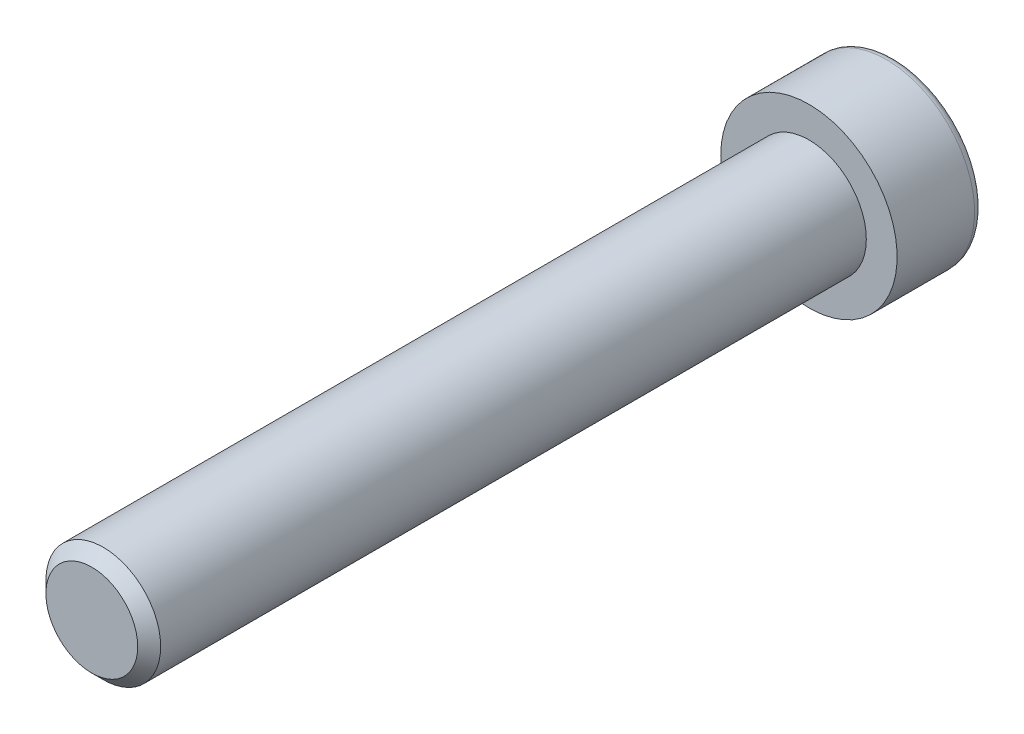
from build123d import *

# Parameters (mm, degrees)
ENLEV_MAT_EXTRU1_DEPTH = 3
ESQUISSE3_W            = 4
ESQUISSE3_H            = 50
CHANFREIN1_SIZE        = 0.8


with BuildPart() as part:
    # Esquisse1 → Base-Révolution (revolve)
    with BuildSketch(Plane(origin=(0, 0, 0), x_dir=(1, 0, 0), z_dir=(0, 1, 0))):
        with BuildLine():
            Line((0, 0), (6.15, 0))
            Line((6.15, 0), (6.15, 5.4))
            ThreePointArc((6.15, 5.4), (5.974264069, 5.824264069), (5.55, 6))
            Line((5.55, 6), (0, 6))
            Line((0, 6), (0, 0))
        make_face()
    revolve(axis=Axis((0, 0, 0), (0, 0, -1)))

    # Esquisse2 → enlev-mat-Extru1 (cut)
    with BuildSketch(Plane.XY.offset(-6)):
        Polygon((3, -1.732050808), (3, 1.732050808), (0, 3.464101615), (-3, 1.732050808), (-3, -1.732050808), (0, -3.464101615), align=None)
    extrude(amount=ENLEV_MAT_EXTRU1_DEPTH, mode=Mode.SUBTRACT)

    # Esquisse3 → Boss.-Révol.1 (revolve)
    with BuildSketch(Plane(origin=(0, 0, 0), x_dir=(1, 0, 0), z_dir=(0, 1, 0))):
        with Locations((2, -25)):
            Rectangle(ESQUISSE3_W, ESQUISSE3_H)
    revolve(axis=Axis((0, 0, 0), (0, 0, 1)))

    # Chanfrein1
    chanfrein1_edges = [part.edges().sort_by_distance(p)[0] for p in [
        (-4, 0, 50),
    ]]
    chamfer(chanfrein1_edges, length=CHANFREIN1_SIZE)


solid = part.part
